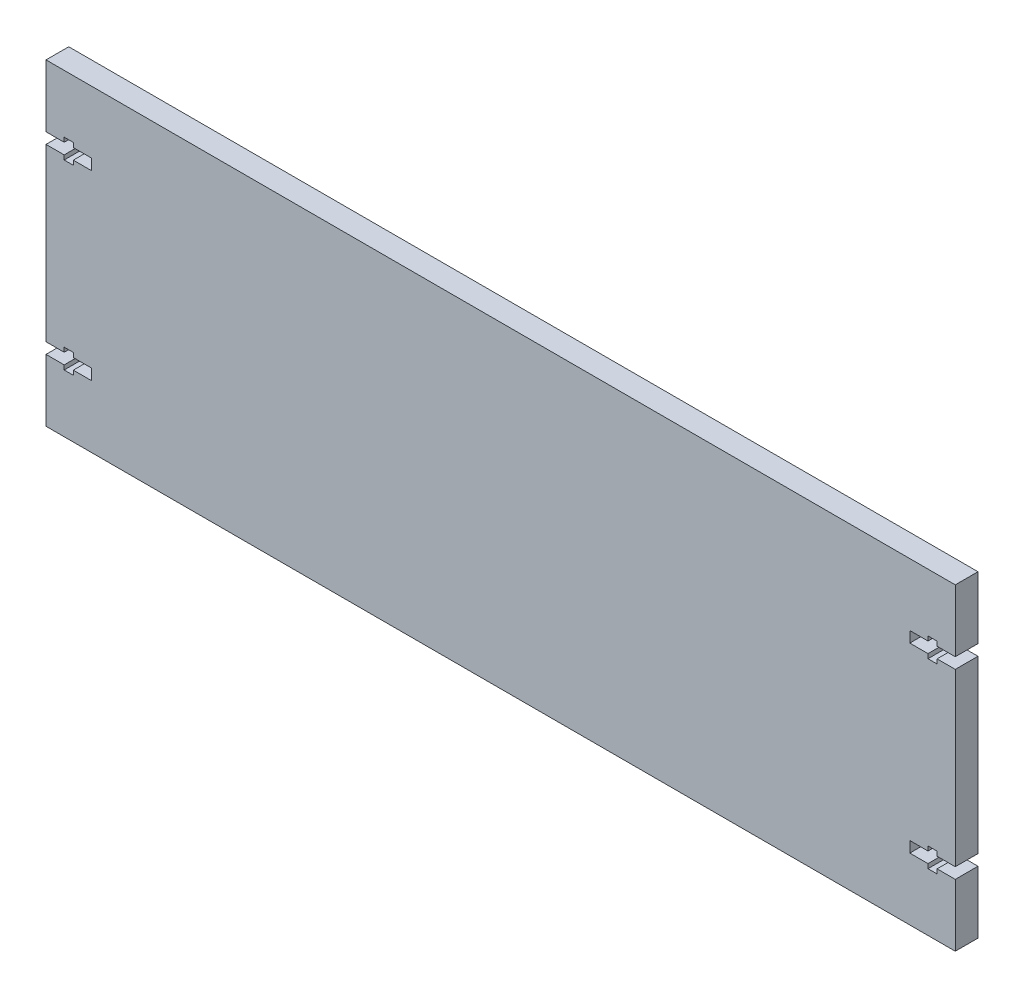
from build123d import *

# Parameters (mm, degrees)
BOSS_EXTRUDE1_DEPTH = 6.35


with BuildPart() as part:
    # Sketch1 → Boss-Extrude1 (new body)
    with BuildSketch(Plane.XY):
        Polygon((0, 17.399), (0, 0), (254, 0), (254, 17.399), (248.92, 17.399), (248.92, 16.16075), (246.38, 16.16075), (246.38, 17.399), (241.3, 17.399), (241.3, 20.447), (246.38, 20.447), (246.38, 21.68525), (248.92, 21.68525), (248.92, 20.447), (254, 20.447), (254, 68.199), (248.92, 68.199), (248.92, 66.96075), (246.38, 66.96075), (246.38, 68.199), (241.3, 68.199), (241.3, 71.247), (246.38, 71.247), (246.38, 72.48525), (248.92, 72.48525), (248.92, 71.247), (254, 71.247), (254, 88.646), (0, 88.646), (0, 71.247), (5.08, 71.247), (5.08, 72.48525), (7.62, 72.48525), (7.62, 71.247), (12.7, 71.247), (12.7, 68.199), (7.62, 68.199), (7.62, 66.96075), (5.08, 66.96075), (5.08, 68.199), (0, 68.199), (0, 20.447), (5.08, 20.447), (5.08, 21.68525), (7.62, 21.68525), (7.62, 20.447), (12.7, 20.447), (12.7, 17.399), (7.62, 17.399), (7.62, 16.16075), (5.08, 16.16075), (5.08, 17.399), align=None)
    extrude(amount=BOSS_EXTRUDE1_DEPTH)


solid = part.part
